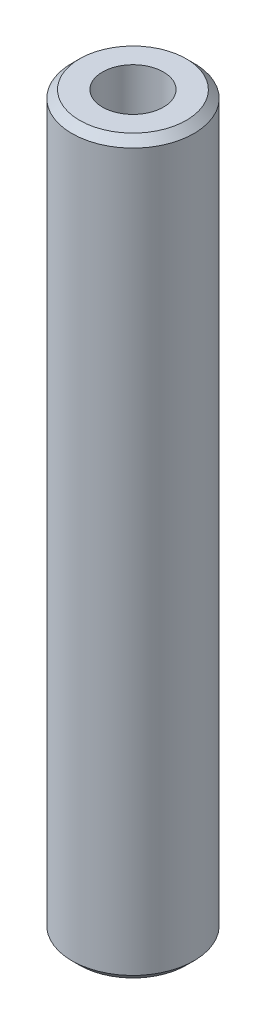
from build123d import *

# Parameters (mm, degrees)
SKETCH1_R           = 4
SKETCH1_R_2         = 2
BOSS_EXTRUDE1_DEPTH = 48
CHAMFER1_SIZE       = 0.5


with BuildPart() as part:
    # Sketch1 → Boss-Extrude1 (new body)
    with BuildSketch(Plane(origin=(0, 0, 0), x_dir=(1, 0, 0), z_dir=(0, 1, 0))):
        with Locations(Location((0, 0, 0), (0, 0, 270))):
            Circle(SKETCH1_R)
        with Locations(Location((0, 0, 0), (0, 0, 270))):
            Circle(SKETCH1_R_2, mode=Mode.SUBTRACT)
    extrude(amount=BOSS_EXTRUDE1_DEPTH)

    # Chamfer1
    chamfer1_edges = [part.edges().sort_by_distance(p)[0] for p in [
        (0, 0, -4),
        (0, 48, -4),
    ]]
    chamfer(chamfer1_edges, length=CHAMFER1_SIZE)


solid = part.part
